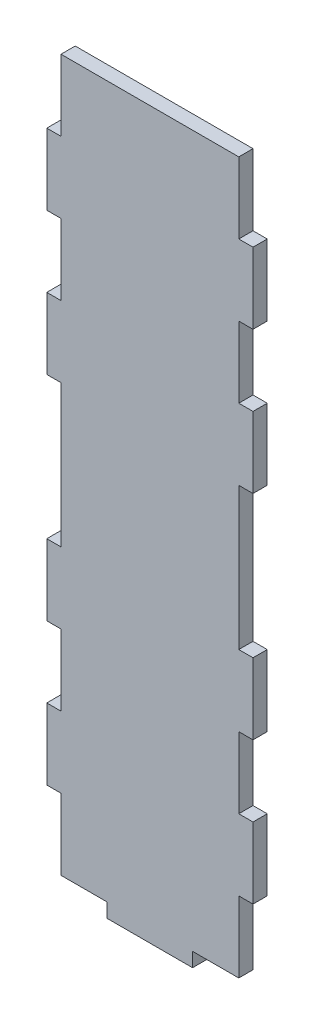
from build123d import *

# Parameters (mm, degrees)
RESSALTO_EXTRUS_O1_DEPTH = 4
CORTE_EXTRUS_O3_DEPTH    = 116.464280191
ESBO_O4_W                = 4
ESBO_O4_H                = 20
RESSALTO_EXTRUS_O2_DEPTH = 4


with BuildPart() as part:
    # Esboço1 → Ressalto-extrusão1 (new body)
    with BuildSketch(Plane.XY):
        Polygon((-50, -100), (-37, -100), (-37, -104), (-13, -104), (-13, -100), (13, -100), (13, -104), (37, -104), (37, -100), (50, -100), (50, 100), (-50, 100), align=None)
    extrude(amount=RESSALTO_EXTRUS_O1_DEPTH)

    # Esboço2 → Corte-extrusão3 (cut, through all)
    with BuildSketch(Plane.XY.offset(4)):
        Polygon((0, 20), (0, 0), (50, 0), (50, 100), (0, 100), (0, 80), (4, 80), (4, 60), (0, 60), (0, 40), (4, 40), (4, 20), align=None)
        Polygon((0, -80), (0, -100), (13, -100), (13, -104), (37, -104), (37, -100), (50, -100), (50, 0), (0, 0), (0, -20), (4, -20), (4, -40), (0, -40), (0, -60), (4, -60), (4, -80), align=None)
    extrude(amount=-CORTE_EXTRUS_O3_DEPTH, mode=Mode.SUBTRACT)

    # Esboço4 → Ressalto-extrusão2 (add)
    with BuildSketch(Plane.XY.offset(4)):
        with Locations((-52, 70)):
            Rectangle(ESBO_O4_W, ESBO_O4_H)
        with Locations((-52, 30)):
            Rectangle(ESBO_O4_W, ESBO_O4_H)
        with Locations((-52, -70)):
            Rectangle(ESBO_O4_W, ESBO_O4_H)
        with Locations((-52, -30)):
            Rectangle(ESBO_O4_W, ESBO_O4_H)
    extrude(amount=-RESSALTO_EXTRUS_O2_DEPTH)


solid = part.part
